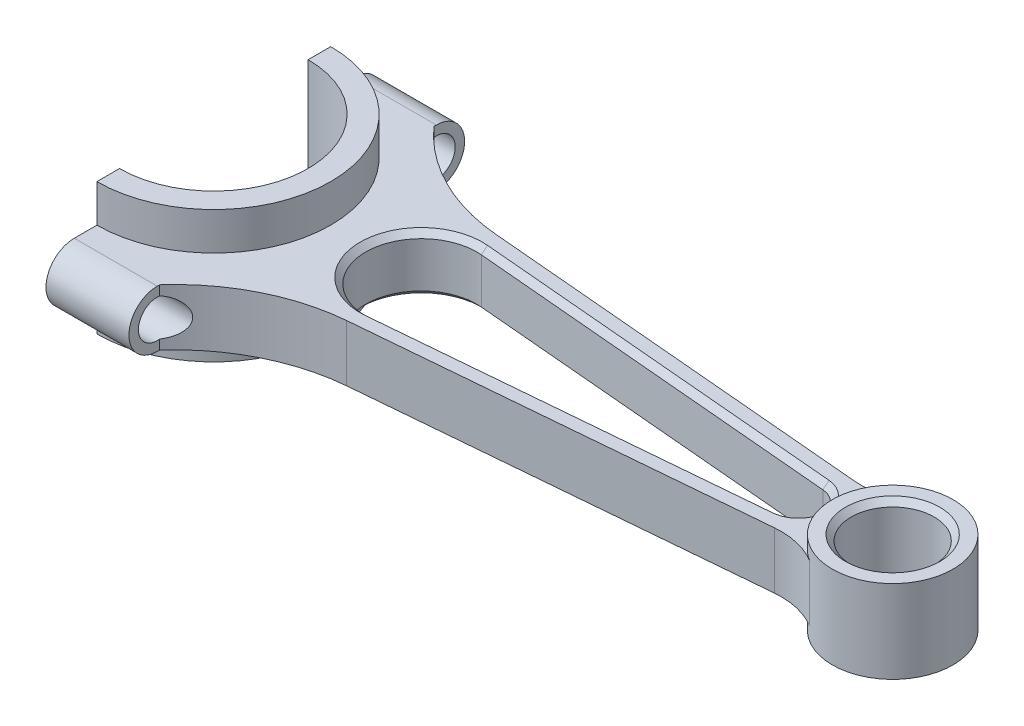
from build123d import *

# Parameters (mm, degrees)
BOSS_EXTRUDE1_DEPTH    = 17.5
SKETCH1_3_R            = 16
SKETCH1_3_R_2          = 11
BOSS_EXTRUDE2_DEPTH    = 11
BOSS_EXTRUDE3_DEPTH    = 7.5
F_10_0MM_DOWEL_HOLE1_D = 10
FILLET1_RADIUS         = 7.5
FILLET1_LENGTH         = 22
FILLET2_RADIUS         = 7.5
FILLET2_LENGTH         = 22
CHAMFER1_SIZE          = 1.5
CHAMFER2_SIZE          = 1.5


with BuildPart() as part:
    # Sketch1 → Boss-Extrude1 (new, symmetric)
    with BuildSketch(Plane(origin=(0, 0, 0), x_dir=(1, 0, 0), z_dir=(0, 1, 0))):
        with BuildLine():
            Line((0, 31), (0, 25))
            ThreePointArc((0, 25), (25, 0), (0, -25))
            Line((0, -25), (0, -31))
            ThreePointArc((0, -31), (31, 0), (0, 31))
        make_face()
    extrude(amount=BOSS_EXTRUDE1_DEPTH, both=True)



with BuildPart() as body_2:
    # Sketch1<3> → Boss-Extrude2 (new, symmetric)
    with BuildSketch(Plane(origin=(0, 0, 0), x_dir=(1, 0, 0), z_dir=(0, 1, 0))):
        with Locations(Location((180, 0, 0), (0, 0, 270))):
            Circle(SKETCH1_3_R)
        with Locations(Location((180, 0, 0), (0, 0, 270))):
            Circle(SKETCH1_3_R_2, mode=Mode.SUBTRACT)
    extrude(amount=BOSS_EXTRUDE2_DEPTH, both=True)


with BuildPart() as part_1:
    add(part.part)

    add(body_2.part)  # Boss-Extrude3 merges body 2
    # Sketch1<4> → Boss-Extrude3 (add, symmetric)
    with BuildSketch(Plane(origin=(0, 0, 0), x_dir=(1, 0, 0), z_dir=(0, 1, 0))):
        with BuildLine():
            Line((0, 44.5), (0, 31))
            ThreePointArc((0, 31), (31, 0), (0, -31))
            Line((0, -31), (0, -44.5))
            Line((0, -44.5), (22, -44.5))
            Line((22, -44.5), (22, -36.368169362))
            ThreePointArc((22, -36.368169362), (36.913436466, -24.9211933), (55, -19.790884566))
            Line((55, -19.790884566), (159.279067997, -10.667648273))
            ThreePointArc((159.279067997, -10.667648273), (165.659496532, -11.136586007), (171.565414601, -13.596240993))
            ThreePointArc((171.565414601, -13.596240993), (164, 0), (171.565414601, 13.596240993))
            ThreePointArc((171.565414601, 13.596240993), (165.659496532, 11.136586007), (159.279067997, 10.667648273))
            Line((159.279067997, 10.667648273), (55, 19.790884566))
            ThreePointArc((55, 19.790884566), (36.913436466, 24.9211933), (22, 36.368169362))
            Line((22, 36.368169362), (22, 44.5))
            Line((22, 44.5), (0, 44.5))
        make_face()
        with BuildLine():
            ThreePointArc((56.282546806, -14.659577072), (40.284425725, 0), (56.282546806, 14.659577072))
            Line((56.282546806, 14.659577072), (155.522934456, 5.977168189))
            ThreePointArc((155.522934456, 5.977168189), (161, 0), (155.522934456, -5.977168189))
            Line((155.522934456, -5.977168189), (56.282546806, -14.659577072))
        make_face(mode=Mode.SUBTRACT)
    extrude(amount=BOSS_EXTRUDE3_DEPTH, both=True)

    # Ø10.0mm Dowel Hole1 (through all)
    with Locations(Plane.ZY):
        with Locations((-37, 0), (37, 0)):
            Hole(F_10_0MM_DOWEL_HOLE1_D / 2)

    # Fillet1: full round fillet: the end face becomes a half cylinder, R = half its width
    fillet1_face = Plane((11, 0, 44.5), x_dir=(1, 0, 0), z_dir=(0, 0, 1))  # on the end face: x along it, z out of the body
    fillet1_slab = fillet1_face.offset(-FILLET1_RADIUS / 2) * Box(FILLET1_LENGTH, 2 * FILLET1_RADIUS, FILLET1_RADIUS, mode=Mode.PRIVATE)  # the body's end, R deep
    fillet1_round = Plane((11, 0, 37), x_dir=(0, 0, 1), z_dir=(1, 0, 0)) * Cylinder(FILLET1_RADIUS, FILLET1_LENGTH, mode=Mode.PRIVATE)  # its axis R under the face
    add(fillet1_slab - fillet1_round, mode=Mode.SUBTRACT)

    # Fillet2: full round fillet: the end face becomes a half cylinder, R = half its width
    fillet2_face = Plane((11, 0, -44.5), x_dir=(1, 0, 0), z_dir=(0, 0, -1))  # on the end face: x along it, z out of the body
    fillet2_slab = fillet2_face.offset(-FILLET2_RADIUS / 2) * Box(FILLET2_LENGTH, 2 * FILLET2_RADIUS, FILLET2_RADIUS, mode=Mode.PRIVATE)  # the body's end, R deep
    fillet2_round = Plane((11, 0, -37), x_dir=(0, 0, -1), z_dir=(1, 0, 0)) * Cylinder(FILLET2_RADIUS, FILLET2_LENGTH, mode=Mode.PRIVATE)  # its axis R under the face
    add(fillet2_slab - fillet2_round, mode=Mode.SUBTRACT)

    # Chamfer1
    chamfer1_edges = [part_1.edges().sort_by_distance(p)[0] for p in [
        (105.902740631, -7.5, 10.31837263),
        (40.284425725, -7.5, 0),
        (105.902740631, -7.5, -10.31837263),
        (161, -7.5, 0),
        (105.902740631, 7.5, 10.31837263),
        (40.284425725, 7.5, 0),
        (105.902740631, 7.5, -10.31837263),
        (161, 7.5, 0),
    ]]
    chamfer(chamfer1_edges, length=CHAMFER1_SIZE)

    # Chamfer2
    chamfer2_edges = [part_1.edges().sort_by_distance(p)[0] for p in [
        (180, 11, -11),
        (180, -11, -11),
    ]]
    chamfer(chamfer2_edges, length=CHAMFER2_SIZE)


solid = part_1.part
